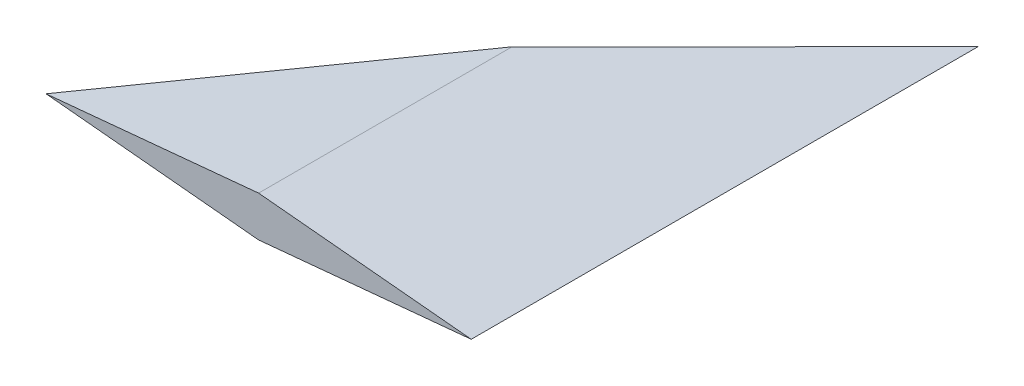
from build123d import *

# Parameters (mm, degrees)
BOSS_EXTRUDE1_DEPTH = 2.54
CUT_EXTRUDE1_DEPTH  = 52.578


with BuildPart() as part:
    # Sketch1 → Boss-Extrude1 (new body)
    with BuildSketch(Plane(origin=(0, 0, 0), x_dir=(1, 0, 0), z_dir=(0, 1, 0))):
        Polygon((0, 26.8305841), (0, -4.885187934), (-26.612692616, -4.885187934), align=None)
    extrude(amount=BOSS_EXTRUDE1_DEPTH)

    # Sketch2 → Cut-Extrude1 (cut)
    with BuildSketch(Plane.XY.offset(4.885187934)):
        Polygon((-26.612692616, 2.54), (-26.612692616, 1.27), (-13.306346308, 2.54), align=None)
        Polygon((-13.306346308, 0), (-26.612692616, 1.27), (-26.612692616, 0), align=None)
        Polygon((0, 2.54), (-13.306346308, 2.54), (0, 1.27), align=None)
        Polygon((0, 1.27), (-13.306346308, 0), (0, 0), align=None)
    extrude(amount=-CUT_EXTRUDE1_DEPTH, mode=Mode.SUBTRACT)


solid = part.part
